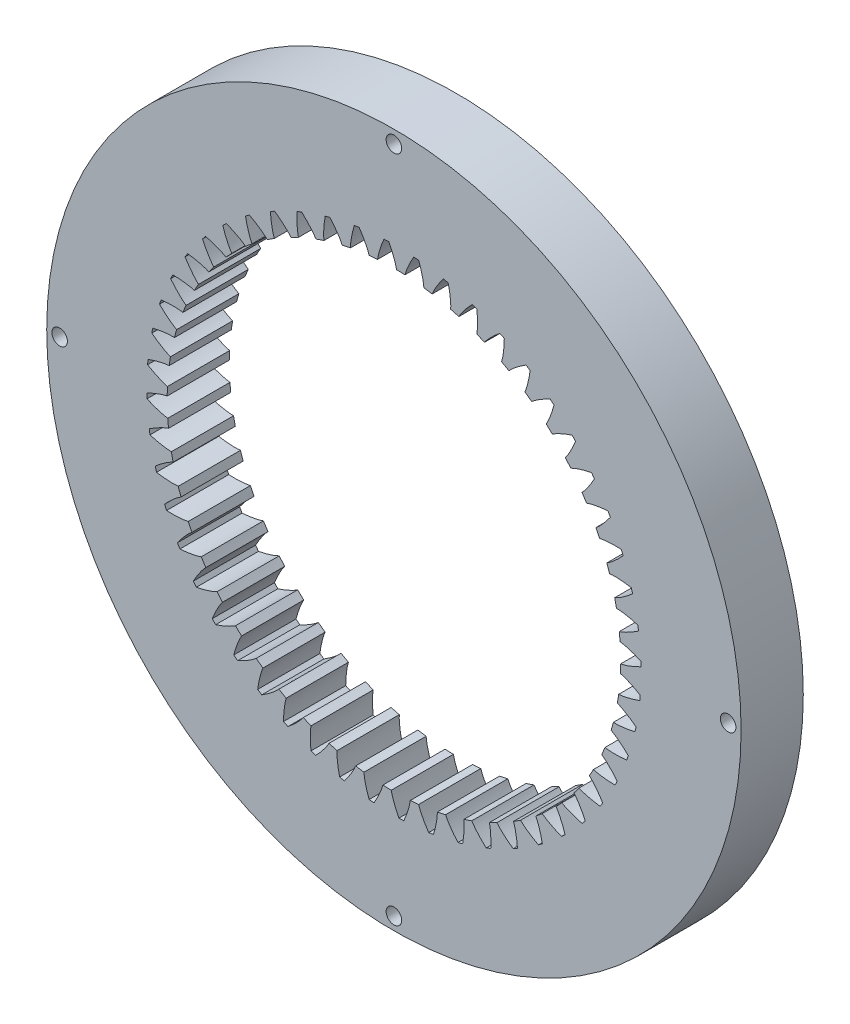
from build123d import *

# Parameters (mm, degrees)
SKETCH1_W          = 12
SKETCH1_H          = 67
CUT_EXTRUDE1_DEPTH = 96.509161864
CIRPATTERN1_COUNT  = 52
SKETCH5_R          = 43.75
CUT_EXTRUDE2_DEPTH = 96.509162017
SKETCH6_R          = 1.5
CUT_EXTRUDE3_DEPTH = 96.509162017


with BuildPart() as part:
    # Sketch1 → Revolve1 (revolve)
    with BuildSketch(Plane(origin=(0, 0, 0), x_dir=(0, 0, -1), z_dir=(1, 0, 0)), mode=Mode.PRIVATE) as revolve1_sk:
        with Locations((0, 33.5)):
            Rectangle(SKETCH1_W, SKETCH1_H)
    revolve(revolve1_sk.sketch.rotate(Axis((0, 0, 0), (0, 0, 1)), 90), axis=Axis((0, 0, 0), (0, 0, 1)))

    # Sketch4 → Cut-Extrude1 (cut, through all)
    with BuildSketch(Plane.XY.offset(6)):
        with BuildLine():
            add(Edge.make_bspline(
                [(-1.913266706, 47.649103525), (-2.235284164, 46.923222914), (-2.732366853, 45.608892054), (-3.070542835, 44.238598307), (-3.150931741, 43.636385381)],
                knots=[0.705309079, 0.705309079, 0.705309079, 0.705309079, 0.839980712, 0.943169174, 0.943169174, 0.943169174, 0.943169174], degree=3))
            ThreePointArc((-3.150931741, 43.636385381), (-1.321382466, 43.730040571), (0.510483655, 43.747021686))
            add(Edge.make_bspline(
                [(-0.967205219, 47.677690488), (-0.601947684, 46.972577137), (-0.026414574, 45.690657308), (0.393880702, 44.343282146), (0.510483655, 43.747021686)],
                knots=[0.705309079, 0.705309079, 0.705309079, 0.705309079, 0.839980712, 0.943169174, 0.943169174, 0.943169174, 0.943169174], degree=3))
            ThreePointArc((-0.967205219, 47.677690488), (-1.440306888, 47.665744223), (-1.913266706, 47.649103525))
        make_face()
    cut_extrude1 = extrude(amount=-CUT_EXTRUDE1_DEPTH, mode=Mode.SUBTRACT)

    # CirPattern1: Cut-Extrude1 ×52 about axis
    cirpattern1_axis = Axis((0, 0, -6), (0, 0, 1))
    for i in range(1, CIRPATTERN1_COUNT):
        add(cut_extrude1.rotate(cirpattern1_axis, i * 360 / CIRPATTERN1_COUNT), mode=Mode.SUBTRACT)

    # Sketch5 → Cut-Extrude2 (cut, through all)
    with BuildSketch(Plane.XY.offset(6)):
        Circle(SKETCH5_R)
    extrude(amount=-CUT_EXTRUDE2_DEPTH, mode=Mode.SUBTRACT)

    # Sketch6 → Cut-Extrude3 (cut, through all)
    with BuildSketch(Plane.XY.offset(6)):
        with Locations((64.5, 0)):
            Circle(SKETCH6_R)
        with Locations((0, 64.5)):
            Circle(SKETCH6_R)
        with Locations((-64.5, 0)):
            Circle(SKETCH6_R)
        with Locations((0, -64.5)):
            Circle(SKETCH6_R)
    extrude(amount=-CUT_EXTRUDE3_DEPTH, mode=Mode.SUBTRACT)


solid = part.part
